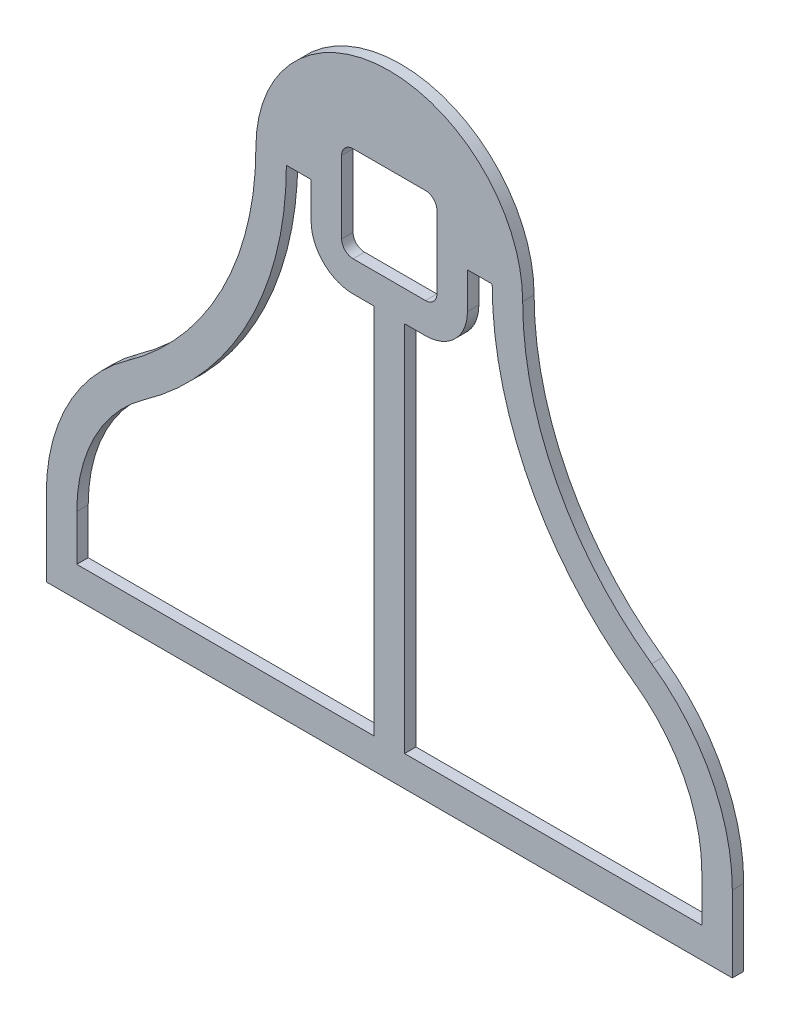
from build123d import *

# Parameters (mm, degrees)
ESQUISSE1_W                  = 180
ESQUISSE1_H                  = 300
BOSS_EXTRU_1_DEPTH           = 15
ESQUISSE2_W                  = 180
ESQUISSE2_H                  = 8.1
ENL_V_MAT_EXTRU_1_DEPTH      = 5
ENL_V_MAT_EXTRU_2_DEPTH      = 10
ENL_V_START                  = -180
ENL_V_MAT_EXTRU_3_DEPTH      = 10
ENL_V_MAT_EXTRU_4_DEPTH      = 351.178525898
ENL_V_MAT_EXTRU_4_DEPTH_BACK = 351.178525898
CONG_1_R                     = 50
ENL_V_MAT_EXTRU_5_DEPTH      = 351.178525898
ENL_V_MAT_EXTRU_5_DEPTH_BACK = 351.178525898
ESQUISSE5_W                  = 25
ESQUISSE5_H                  = 25
CONG_2_R                     = 3
ENL_V_MAT_EXTRU_6_DEPTH      = 351.178525898
ENL_V_MAT_EXTRU_6_DEPTH_BACK = 351.178525898
ESQUISSE6_W                  = 180
ESQUISSE6_H                  = 138.816197092
ENL_V_MAT_EXTRU_7_DEPTH      = 12
ENL_V_MAT_EXTRU_8_DEPTH      = 350.869975848
ENL_V_MAT_EXTRU_8_DEPTH_BACK = 350.869975848
ESQUISSE10_W                 = 8
ESQUISSE10_H                 = 97.683802908
BOSS_EXTRU_2_DEPTH           = 3


with BuildPart() as part:
    # Esquisse1 → Boss.-Extru.1 (new body)
    with BuildSketch(Plane.XY):
        with Locations((90, 150)):
            Rectangle(ESQUISSE1_W, ESQUISSE1_H)
    extrude(amount=BOSS_EXTRU_1_DEPTH)

    # Esquisse2 → Enlèv. mat.-Extru.1 (cut)
    with BuildSketch(Plane.XY.offset(15)):
        with Locations((90, 12.05)):
            Rectangle(ESQUISSE2_W, ESQUISSE2_H)
    extrude(amount=-ENL_V_MAT_EXTRU_1_DEPTH, mode=Mode.SUBTRACT)

    # Esquisse3 → Enlèv. mat.-Extru.2 (cut)
    with BuildSketch(Plane.ZY):
        Polygon((0, 35), (0, 5), (15, 7.644904711), (15, 32.355095289), align=None)
        Polygon((0, 51), (15, 53.644904711), (15, 78.355095289), (0, 81), align=None)
    extrude(amount=-ENL_V_MAT_EXTRU_2_DEPTH, mode=Mode.SUBTRACT)

    # Esquisse3<2> → Enlèv. mat.-Extru.3 (cut)
    with BuildSketch(Plane.ZY.offset(ENL_V_START)):
        Polygon((0, 35), (0, 5), (15, 7.644904711), (15, 32.355095289), align=None)
        Polygon((0, 51), (15, 53.644904711), (15, 78.355095289), (0, 81), align=None)
    extrude(amount=ENL_V_MAT_EXTRU_3_DEPTH, mode=Mode.SUBTRACT)

    # Esquisse4 → Enlèv. mat.-Extru.4 (cut, two sides: drawn at the far end of the back side and taken through both)
    with BuildSketch(Plane(origin=(0, 0, 0), x_dir=(-1, 0, 0), z_dir=(0, 0, -1)).offset(-ENL_V_MAT_EXTRU_4_DEPTH_BACK)):
        with BuildLine():
            Line((0, 189.006579232), (0, 300))
            Line((0, 300), (-90, 310))
            Line((-90, 310), (-180, 300))
            Line((-180, 300), (-180, 189.006579232))
            ThreePointArc((-180, 189.006579232), (-140.192593016, 218.095842402), (-125, 265))
            ThreePointArc((-125, 265), (-90, 300), (-55, 265))
            ThreePointArc((-55, 265), (-39.807406984, 218.095842402), (0, 189.006579232))
        make_face()
    extrude(amount=ENL_V_MAT_EXTRU_4_DEPTH + ENL_V_MAT_EXTRU_4_DEPTH_BACK, mode=Mode.SUBTRACT)

    # Congé1
    cong_1_edges = [part.edges().sort_by_distance(p)[0] for p in [
        (0, 189.006579232, 7.5),
        (180, 189.006579232, 7.5),
    ]]
    fillet(cong_1_edges, radius=CONG_1_R)

    # Esquisse5 → Enlèv. mat.-Extru.5 (cut, two sides: drawn at the far end of the back side and taken through both)
    with BuildSketch(Plane(origin=(0, 0, 0), x_dir=(-1, 0, 0), z_dir=(0, 0, -1)).offset(-ENL_V_MAT_EXTRU_5_DEPTH_BACK)):
        with Locations((-90, 265)):
            Rectangle(ESQUISSE5_W, ESQUISSE5_H)
    extrude(amount=ENL_V_MAT_EXTRU_5_DEPTH + ENL_V_MAT_EXTRU_5_DEPTH_BACK, mode=Mode.SUBTRACT)

    # Congé2
    cong_2_edges = [part.edges().sort_by_distance(p)[0] for p in [
        (77.5, 277.5, 7.5),
        (77.5, 252.5, 7.5),
        (102.5, 252.5, 7.5),
        (102.5, 277.5, 7.5),
    ]]
    fillet(cong_2_edges, radius=CONG_2_R)

    # Esquisse6 → Enlèv. mat.-Extru.6 (cut, two sides: drawn at the far end of the back side and taken through both)
    with BuildSketch(Plane.XY.offset(15).offset(-ENL_V_MAT_EXTRU_6_DEPTH_BACK)):
        with Locations((90, 69.408098546)):
            Rectangle(ESQUISSE6_W, ESQUISSE6_H)
    extrude(amount=ENL_V_MAT_EXTRU_6_DEPTH + ENL_V_MAT_EXTRU_6_DEPTH_BACK, mode=Mode.SUBTRACT)

    # Esquisse8 → Enlèv. mat.-Extru.7 (cut)
    with BuildSketch(Plane.XY.offset(15)):
        with BuildLine():
            Line((0, 158.816197092), (0, 138.816197092))
            Line((0, 138.816197092), (180, 138.816197092))
            Line((180, 138.816197092), (180, 158.816197092))
            ThreePointArc((180, 158.816197092), (174.397678387, 181.812852367), (158.846153846, 199.656121287))
            ThreePointArc((158.846153846, 199.656121287), (133.963714581, 228.20535156), (125, 265))
            ThreePointArc((125, 265), (90, 300), (55, 265))
            ThreePointArc((55, 265), (46.036285419, 228.20535156), (21.153846154, 199.656121287))
            ThreePointArc((21.153846154, 199.656121287), (5.602321613, 181.812852367), (0, 158.816197092))
        make_face()
        with BuildLine():
            Line((102.5, 274.5), (102.5, 255.5))
            ThreePointArc((102.5, 255.5), (101.621320344, 253.378679656), (99.5, 252.5))
            Line((99.5, 252.5), (80.5, 252.5))
            ThreePointArc((80.5, 252.5), (78.378679656, 253.378679656), (77.5, 255.5))
            Line((77.5, 255.5), (77.5, 274.5))
            ThreePointArc((77.5, 274.5), (78.378679656, 276.621320344), (80.5, 277.5))
            Line((80.5, 277.5), (99.5, 277.5))
            ThreePointArc((99.5, 277.5), (101.621320344, 276.621320344), (102.5, 274.5))
        make_face(mode=Mode.SUBTRACT)
    extrude(amount=-ENL_V_MAT_EXTRU_7_DEPTH, mode=Mode.SUBTRACT)

    # Esquisse9 → Enlèv. mat.-Extru.8 (cut, two sides: drawn at the far end of the back side and taken through both)
    with BuildSketch(Plane.XY.offset(3).offset(-ENL_V_MAT_EXTRU_8_DEPTH_BACK)):
        with BuildLine():
            Line((110.5, 255.5), (110.5, 265))
            Line((110.5, 265), (117, 265))
            ThreePointArc((117, 265), (126.860086039, 224.525886716), (154.230769231, 193.121733416))
            ThreePointArc((154.230769231, 193.121733416), (167.294049845, 178.133387523), (172, 158.816197092))
            Line((172, 158.816197092), (172, 146.816197092))
            Line((172, 146.816197092), (8, 146.816197092))
            Line((8, 146.816197092), (8, 158.816197092))
            ThreePointArc((8, 158.816197092), (12.705950155, 178.133387523), (25.769230769, 193.121733416))
            ThreePointArc((25.769230769, 193.121733416), (53.139913961, 224.525886716), (63, 265))
            Line((63, 265), (69.5, 265))
            Line((69.5, 265), (69.5, 255.5))
            ThreePointArc((69.5, 255.5), (72.721825407, 247.721825407), (80.5, 244.5))
            Line((80.5, 244.5), (99.5, 244.5))
            ThreePointArc((99.5, 244.5), (107.278174593, 247.721825407), (110.5, 255.5))
        make_face()
    extrude(amount=ENL_V_MAT_EXTRU_8_DEPTH + ENL_V_MAT_EXTRU_8_DEPTH_BACK, mode=Mode.SUBTRACT)

    # Esquisse10 → Boss.-Extru.2 (add)
    with BuildSketch(Plane.XY.offset(3)):
        with Locations((90, 195.658098546)):
            Rectangle(ESQUISSE10_W, ESQUISSE10_H)
    extrude(amount=-BOSS_EXTRU_2_DEPTH)


solid = part.part
